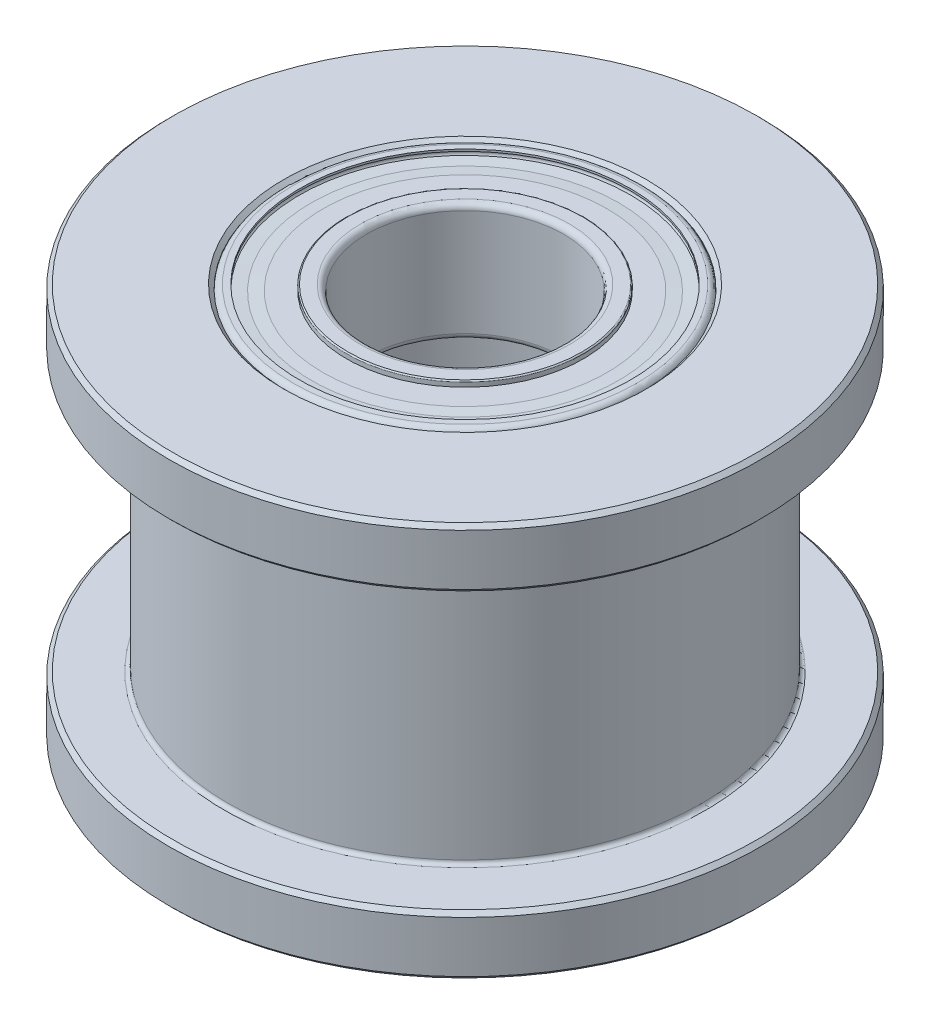
from build123d import *

# Parameters (mm, degrees)
ZKOSEN_1_SIZE      = 0.1
ZAOBLIT1_R         = 0.1
KRUHOV_POLE1_COUNT = 8
KRUHOV_POLE3_COUNT = 8


with BuildPart() as part:
    # Skica1 → Rotovat1 (revolve)
    with BuildSketch(Plane.XY, mode=Mode.PRIVATE) as rotovat1_sk:
        Polygon((4.5, 10), (7.5, 10), (7.5, 8.5), (6, 8.5), (6, 1.5), (7.5, 1.5), (7.5, 0), (4.5, 0), (4.5, 3), (3.5, 3), (3.5, 7), (4.5, 7), align=None)
    revolve(rotovat1_sk.sketch.rotate(Axis((0, 0, 0), (0, -1, 0)), 90), axis=Axis((0, 0, 0), (0, -1, 0)))

    # Zkosení1
    zkosen_1_edges = [part.edges().sort_by_distance(p)[0] for p in [
        (0, 3, -3.5),
        (0, 0, -4.5),
        (0, 0, -7.5),
        (0, 1.5, -7.5),
        (0, 8.5, -7.5),
        (0, 10, -7.5),
        (0, 10, -4.5),
        (0, 7, -3.5),
    ]]
    chamfer(zkosen_1_edges, length=ZKOSEN_1_SIZE)

    # Zaoblit1
    zaoblit1_edges = [part.edges().sort_by_distance(p)[0] for p in [
        (0, 3, -4.5),
        (0, 1.5, -6),
        (0, 8.5, -6),
        (0, 7, -4.5),
    ]]
    fillet(zaoblit1_edges, radius=ZAOBLIT1_R)


with BuildPart() as body_2:
    # Skica4 → Rotovat2 (revolve)
    with BuildSketch(Plane.XY, mode=Mode.PRIVATE) as rotovat2_sk:
        with BuildLine():
            Line((4.5, 9.85), (4.5, 7.15))
            ThreePointArc((4.5, 7.15), (4.456066017, 7.043933983), (4.35, 7))
            Line((4.35, 7), (4.2, 7))
            Line((4.2, 7), (4.2, 7.05))
            ThreePointArc((4.2, 7.05), (4.289757174, 7.133393211), (4.213177928, 7.229030007))
            Line((4.213177928, 7.229030007), (3.85, 7.282786405))
            Line((3.85, 7.282786405), (3.85, 8.052786405))
            ThreePointArc((3.85, 8.052786405), (4.05, 8.5), (3.85, 8.947213595))
            Line((3.85, 8.947213595), (3.85, 9.717213595))
            Line((3.85, 9.717213595), (4.213177928, 9.770969993))
            ThreePointArc((4.213177928, 9.770969993), (4.289757174, 9.866606789), (4.2, 9.95))
            Line((4.2, 9.95), (4.2, 10))
            Line((4.2, 10), (4.35, 10))
            ThreePointArc((4.35, 10), (4.456066017, 9.956066017), (4.5, 9.85))
        make_face()
    revolve(rotovat2_sk.sketch.rotate(Axis((0, 0, 0), (0, 1, 0)), 90), axis=Axis((0, 0, 0), (0, 1, 0)))


with BuildPart() as body_3:
    # Skica5 → Rotovat3 (revolve)
    with BuildSketch(Plane.XY, mode=Mode.PRIVATE) as rotovat3_sk:
        with BuildLine():
            Line((2.5, 9.85), (2.5, 7.15))
            ThreePointArc((2.5, 7.15), (2.543933983, 7.043933983), (2.65, 7))
            Line((2.65, 7), (2.97, 7))
            ThreePointArc((2.97, 7), (2.991213203, 7.008786797), (3, 7.03))
            Line((3, 7.03), (3, 7.14))
            Line((3, 7.14), (3.6, 7.14))
            Line((3.6, 7.14), (3.896185034, 7.191714847))
            Line((3.896185034, 7.191714847), (4.192370069, 7.14))
            Line((4.192370069, 7.14), (4.192370069, 7.19))
            Line((4.192370069, 7.19), (3.897467562, 7.258062558))
            Line((3.897467562, 7.258062558), (3.597467562, 7.258062558))
            Line((3.597467562, 7.258062558), (3, 7.19))
            Line((3, 7.19), (3, 8.103137303))
            ThreePointArc((3, 8.103137303), (2.85, 8.5), (3, 8.896862697))
            Line((3, 8.896862697), (3, 9.81))
            Line((3, 9.81), (3.6, 9.77))
            Line((3.6, 9.77), (3.9, 9.77))
            Line((3.9, 9.77), (4.2, 9.81))
            Line((4.2, 9.81), (4.2, 9.86))
            Line((4.2, 9.86), (3.9, 9.84))
            Line((3.9, 9.84), (3.6, 9.86))
            Line((3.6, 9.86), (3, 9.86))
            Line((3, 9.86), (3, 9.97))
            ThreePointArc((3, 9.97), (2.991213203, 9.991213203), (2.97, 10))
            Line((2.97, 10), (2.65, 10))
            ThreePointArc((2.65, 10), (2.543933983, 9.956066017), (2.5, 9.85))
        make_face()
    revolve(rotovat3_sk.sketch.rotate(Axis((0, 0, 0), (0, 1, 0)), 90), axis=Axis((0, 0, 0), (0, 1, 0)))


with BuildPart() as body_4:
    # Skica6 → Rotovat4 (revolve)
    with BuildSketch(Plane.XY):
        with BuildLine():
            Line((3.45, 9.1), (3.45, 7.9))
            ThreePointArc((3.45, 7.9), (4.05, 8.5), (3.45, 9.1))
        make_face()
    revolve(axis=Axis((3.45, 9.1, 0), (0, -1, 0)))


with BuildPart() as kruhov_pole1_1:
    # Kruhové pole1: pattern copy
    add(body_4.part.rotate(Axis((0, 0, 0), (0, 1, 0)), 1 * 360 / KRUHOV_POLE1_COUNT))


with BuildPart() as kruhov_pole1_2:
    # Kruhové pole1: pattern copy
    add(body_4.part.rotate(Axis((0, 0, 0), (0, 1, 0)), 2 * 360 / KRUHOV_POLE1_COUNT))


with BuildPart() as kruhov_pole1_3:
    # Kruhové pole1: pattern copy
    add(body_4.part.rotate(Axis((0, 0, 0), (0, 1, 0)), 3 * 360 / KRUHOV_POLE1_COUNT))


with BuildPart() as kruhov_pole1_4:
    # Kruhové pole1: pattern copy
    add(body_4.part.rotate(Axis((0, 0, 0), (0, 1, 0)), 4 * 360 / KRUHOV_POLE1_COUNT))


with BuildPart() as kruhov_pole1_5:
    # Kruhové pole1: pattern copy
    add(body_4.part.rotate(Axis((0, 0, 0), (0, 1, 0)), 5 * 360 / KRUHOV_POLE1_COUNT))


with BuildPart() as kruhov_pole1_6:
    # Kruhové pole1: pattern copy
    add(body_4.part.rotate(Axis((0, 0, 0), (0, 1, 0)), 6 * 360 / KRUHOV_POLE1_COUNT))


with BuildPart() as kruhov_pole1_7:
    # Kruhové pole1: pattern copy
    add(body_4.part.rotate(Axis((0, 0, 0), (0, 1, 0)), 7 * 360 / KRUHOV_POLE1_COUNT))


with BuildPart() as body_12:
    # Skica7 → Rotovat5 (revolve)
    with BuildSketch(Plane.XY, mode=Mode.PRIVATE) as rotovat5_sk:
        with BuildLine():
            Line((4.5, 2.85), (4.5, 0.15))
            ThreePointArc((4.5, 0.15), (4.456066017, 0.043933983), (4.35, 0))
            Line((4.35, 0), (4.2, 0))
            Line((4.2, 0), (4.2, 0.05))
            ThreePointArc((4.2, 0.05), (4.289757174, 0.133393211), (4.213177928, 0.229030007))
            Line((4.213177928, 0.229030007), (3.85, 0.282786405))
            Line((3.85, 0.282786405), (3.85, 1.052786405))
            ThreePointArc((3.85, 1.052786405), (4.05, 1.5), (3.85, 1.947213595))
            Line((3.85, 1.947213595), (3.85, 2.717213595))
            Line((3.85, 2.717213595), (4.213177928, 2.770969993))
            ThreePointArc((4.213177928, 2.770969993), (4.289757174, 2.866606789), (4.2, 2.95))
            Line((4.2, 2.95), (4.2, 3))
            Line((4.2, 3), (4.35, 3))
            ThreePointArc((4.35, 3), (4.456066017, 2.956066017), (4.5, 2.85))
        make_face()
    revolve(rotovat5_sk.sketch.rotate(Axis((0, 0, 0), (0, 1, 0)), 90), axis=Axis((0, 0, 0), (0, 1, 0)))


with BuildPart() as body_13:
    # Skica8 → Rotovat6 (revolve)
    with BuildSketch(Plane.XY, mode=Mode.PRIVATE) as rotovat6_sk:
        with BuildLine():
            Line((2.5, 2.85), (2.5, 0.15))
            ThreePointArc((2.5, 0.15), (2.543933983, 0.043933983), (2.65, 0))
            Line((2.65, 0), (2.97, 0))
            ThreePointArc((2.97, 0), (2.991213203, 0.008786797), (3, 0.03))
            Line((3, 0.03), (3, 0.14))
            Line((3, 0.14), (3.6, 0.14))
            Line((3.6, 0.14), (3.896185034, 0.191714847))
            Line((3.896185034, 0.191714847), (4.192370069, 0.14))
            Line((4.192370069, 0.14), (4.192370069, 0.19))
            Line((4.192370069, 0.19), (3.897467562, 0.258062558))
            Line((3.897467562, 0.258062558), (3.597467562, 0.258062558))
            Line((3.597467562, 0.258062558), (3, 0.19))
            Line((3, 0.19), (3, 1.103137303))
            ThreePointArc((3, 1.103137303), (2.85, 1.5), (3, 1.896862697))
            Line((3, 1.896862697), (3, 2.81))
            Line((3, 2.81), (3.6, 2.77))
            Line((3.6, 2.77), (3.9, 2.77))
            Line((3.9, 2.77), (4.2, 2.81))
            Line((4.2, 2.81), (4.2, 2.86))
            Line((4.2, 2.86), (3.9, 2.84))
            Line((3.9, 2.84), (3.6, 2.86))
            Line((3.6, 2.86), (3, 2.86))
            Line((3, 2.86), (3, 2.97))
            ThreePointArc((3, 2.97), (2.991213203, 2.991213203), (2.97, 3))
            Line((2.97, 3), (2.65, 3))
            ThreePointArc((2.65, 3), (2.543933983, 2.956066017), (2.5, 2.85))
        make_face()
    revolve(rotovat6_sk.sketch.rotate(Axis((0, 0, 0), (0, -1, 0)), 180), axis=Axis((0, 0, 0), (0, -1, 0)))


with BuildPart() as body_14:
    # Skica9 → Rotovat7 (revolve)
    with BuildSketch(Plane.XY):
        with BuildLine():
            Line((3.45, 2.1), (3.45, 0.9))
            ThreePointArc((3.45, 0.9), (4.05, 1.5), (3.45, 2.1))
        make_face()
    revolve(axis=Axis((3.45, 2.1, 0), (0, -1, 0)))


with BuildPart() as kruhov_pole3_1:
    # Kruhové pole3: pattern copy
    add(body_14.part.rotate(Axis((0, 0, 0), (0, 1, 0)), 1 * 360 / KRUHOV_POLE3_COUNT))


with BuildPart() as kruhov_pole3_2:
    # Kruhové pole3: pattern copy
    add(body_14.part.rotate(Axis((0, 0, 0), (0, 1, 0)), 2 * 360 / KRUHOV_POLE3_COUNT))


with BuildPart() as kruhov_pole3_3:
    # Kruhové pole3: pattern copy
    add(body_14.part.rotate(Axis((0, 0, 0), (0, 1, 0)), 3 * 360 / KRUHOV_POLE3_COUNT))


with BuildPart() as kruhov_pole3_4:
    # Kruhové pole3: pattern copy
    add(body_14.part.rotate(Axis((0, 0, 0), (0, 1, 0)), 4 * 360 / KRUHOV_POLE3_COUNT))


with BuildPart() as kruhov_pole3_5:
    # Kruhové pole3: pattern copy
    add(body_14.part.rotate(Axis((0, 0, 0), (0, 1, 0)), 5 * 360 / KRUHOV_POLE3_COUNT))


with BuildPart() as kruhov_pole3_6:
    # Kruhové pole3: pattern copy
    add(body_14.part.rotate(Axis((0, 0, 0), (0, 1, 0)), 6 * 360 / KRUHOV_POLE3_COUNT))


with BuildPart() as kruhov_pole3_7:
    # Kruhové pole3: pattern copy
    add(body_14.part.rotate(Axis((0, 0, 0), (0, 1, 0)), 7 * 360 / KRUHOV_POLE3_COUNT))


solid = Compound([part.part, body_2.part, body_3.part, body_4.part, kruhov_pole1_1.part, kruhov_pole1_2.part, kruhov_pole1_3.part, kruhov_pole1_4.part, kruhov_pole1_5.part, kruhov_pole1_6.part, kruhov_pole1_7.part, body_12.part, body_13.part, body_14.part, kruhov_pole3_1.part, kruhov_pole3_2.part, kruhov_pole3_3.part, kruhov_pole3_4.part, kruhov_pole3_5.part, kruhov_pole3_6.part, kruhov_pole3_7.part])
